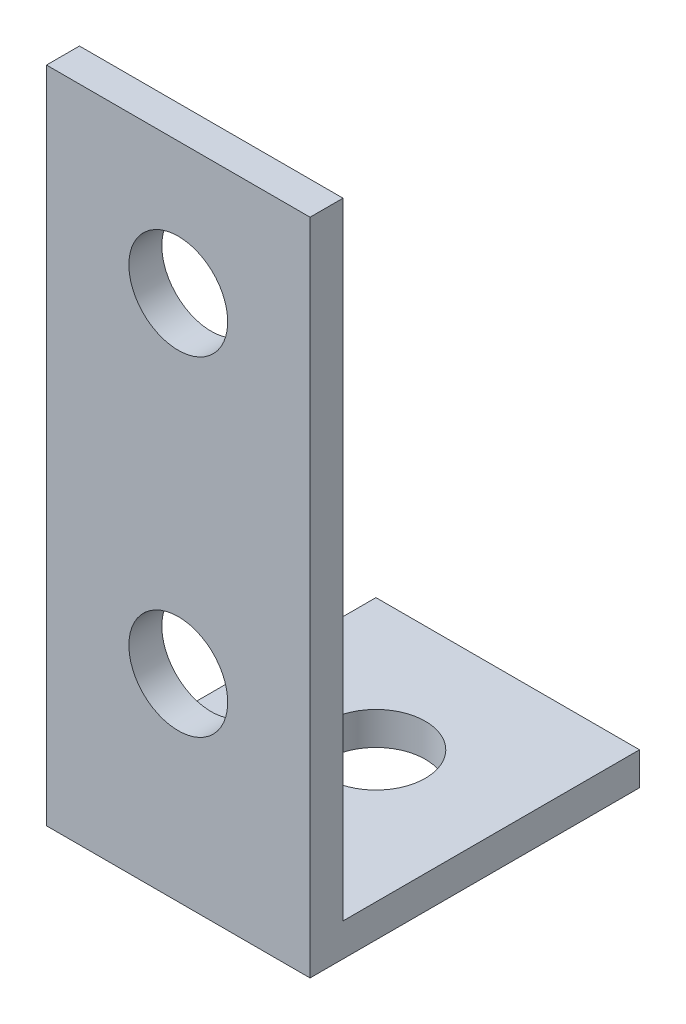
from build123d import *

# Parameters (mm, degrees)
EXTRUDE_1_DEPTH     = 8
SKETCH_2_R          = 1.5
CUT_EXTRUDE_1_DEPTH = 23.912878475
SKETCH_3_R          = 1.5
CUT_EXTRUDE_2_DEPTH = 24.34523506


with BuildPart() as part:
    # 草图1 → 凸台-拉伸1 (new body)
    with BuildSketch(Plane(origin=(0, 0, 0), x_dir=(0, 0, -1), z_dir=(1, 0, 0))):
        Polygon((0, 0), (10, 0), (10, 1), (1, 1), (1, 20), (0, 20), align=None)
    extrude(amount=EXTRUDE_1_DEPTH)

    # 草图2 → 切除-拉伸1 (cut, through all)
    with BuildSketch(Plane(origin=(0, 1, 0), x_dir=(1, 0, 0), z_dir=(0, 1, 0))):
        with Locations(Location((4, 6, 0), (0, 0, 270))):
            Circle(SKETCH_2_R)
    extrude(amount=-CUT_EXTRUDE_1_DEPTH, mode=Mode.SUBTRACT)

    # 草图3 → 切除-拉伸2 (cut, through all)
    with BuildSketch(Plane(origin=(0, 0, -1), x_dir=(-1, 0, 0), z_dir=(0, 0, -1))):
        with Locations(Location((-4, 16, 0), (0, 0, 90))):
            Circle(SKETCH_3_R)
        with Locations(Location((-4, 6, 0), (0, 0, 90))):
            Circle(SKETCH_3_R)
    extrude(amount=-CUT_EXTRUDE_2_DEPTH, mode=Mode.SUBTRACT)


solid = part.part
